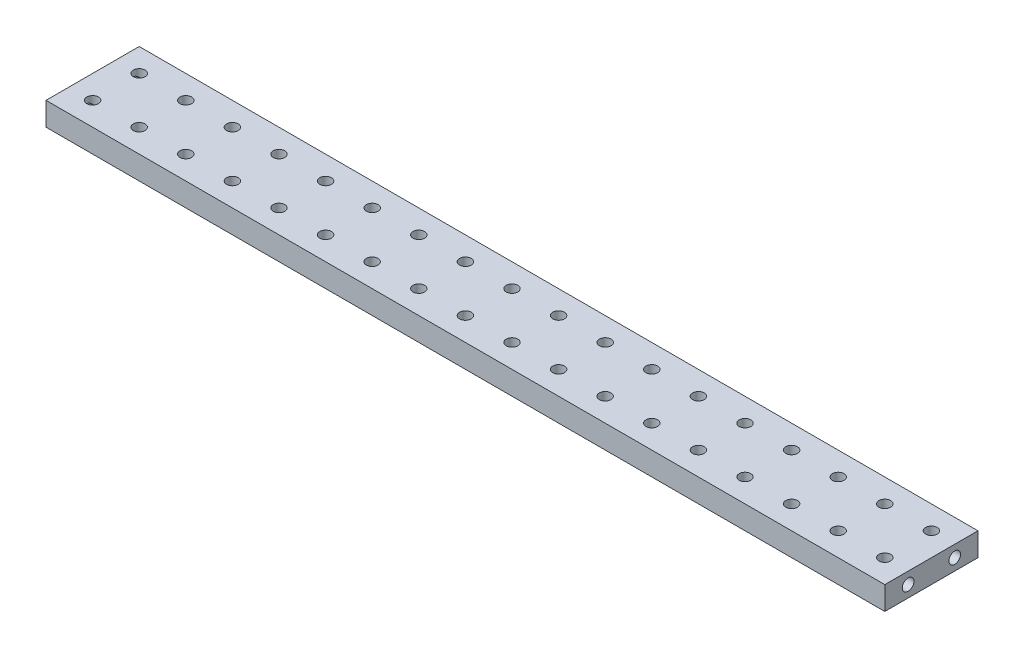
from build123d import *

# Parameters (mm, degrees)
SKETCH1_W           = 457.19999999999993
SKETCH1_H           = 50.79999999999999
BOSS_EXTRUDE1_DEPTH = 12.7
SKETCH2_R           = 3.1750000000000016
CUT_EXTRUDE1_DEPTH  = 12.7
CUT_EXTRUDE2_START  = -12.7
SKETCH3_R           = 3.1750000000000016
CUT_EXTRUDE2_DEPTH  = 12.7
SKETCH4_R           = 3.1749999999999963
SKETCH4_R_2         = 3.1749999999999674
SKETCH4_R_3         = 3.174999999999969
SKETCH4_R_4         = 3.1749999999999976
SKETCH4_R_5         = 3.17499999999997
CUT_EXTRUDE3_DEPTH  = 231.3571357696566


with BuildPart() as part:
    # Sketch1 → Boss-Extrude1 (new body)
    with BuildSketch(Plane(origin=(0, 0, 0), x_dir=(1, 0, 0), z_dir=(0, 1, 0))):
        Rectangle(SKETCH1_W, SKETCH1_H)
    extrude(amount=BOSS_EXTRUDE1_DEPTH)

    # Sketch2 → Cut-Extrude1 (cut)
    with BuildSketch(Plane.ZY.offset(228.6)):
        with Locations((-12.699999999999996, 6.35)):
            Circle(SKETCH2_R)
        with Locations((12.700000000000003, 6.35)):
            Circle(SKETCH2_R)
    extrude(amount=-CUT_EXTRUDE1_DEPTH, mode=Mode.SUBTRACT)

    # Sketch3 → Cut-Extrude2 (cut)
    with BuildSketch(Plane(origin=(228.6, 0, 0), x_dir=(0, 0, -1), z_dir=(1, 0, 0)).offset(CUT_EXTRUDE2_START)):
        with Locations(Location((-12.699999999999996, 6.35, 0), (0, 0, 180))):
            Circle(SKETCH3_R)
        with Locations(Location((12.700000000000003, 6.35, 0), (0, 0, 180))):
            Circle(SKETCH3_R)
    extrude(amount=CUT_EXTRUDE2_DEPTH, mode=Mode.SUBTRACT)

    # Sketch4 → Cut-Extrude3 (cut, through all)
    with BuildSketch(Plane(origin=(0, 12.7, 0), x_dir=(1, 0, 0), z_dir=(0, 1, 0))):
        with Locations(Location((-215.9, 12.699999999999996, 0), (0, 0, 270))):
            Circle(SKETCH4_R)
        with Locations(Location((-190.50000000000003, 12.699999999999996, 0), (0, 0, 270))):
            Circle(SKETCH4_R)
        with Locations(Location((-165.10000000000005, 12.699999999999996, 0), (0, 0, 270))):
            Circle(SKETCH4_R_2)
        with Locations(Location((-139.7000000000001, 12.699999999999996, 0), (0, 0, 270))):
            Circle(SKETCH4_R_2)
        with Locations(Location((-114.30000000000011, 12.699999999999996, 0), (0, 0, 270))):
            Circle(SKETCH4_R_3)
        with Locations(Location((-88.90000000000015, 12.699999999999996, 0), (0, 0, 270))):
            Circle(SKETCH4_R_3)
        with Locations(Location((-63.50000000000017, 12.699999999999996, 0), (0, 0, 270))):
            Circle(SKETCH4_R_3)
        with Locations(Location((-38.100000000000186, 12.699999999999996, 0), (0, 0, 270))):
            Circle(SKETCH4_R_3)
        with Locations(Location((-12.70000000000021, 12.699999999999996, 0), (0, 0, 270))):
            Circle(SKETCH4_R_3)
        with Locations(Location((12.699999999999767, 12.699999999999996, 0), (0, 0, 270))):
            Circle(SKETCH4_R_3)
        with Locations(Location((38.09999999999972, 12.699999999999996, 0), (0, 0, 270))):
            Circle(SKETCH4_R_3)
        with Locations(Location((63.499999999999694, 12.699999999999996, 0), (0, 0, 270))):
            Circle(SKETCH4_R_3)
        with Locations(Location((88.89999999999968, 12.699999999999996, 0), (0, 0, 270))):
            Circle(SKETCH4_R_4)
        with Locations(Location((114.29999999999966, 12.699999999999996, 0), (0, 0, 270))):
            Circle(SKETCH4_R_4)
        with Locations(Location((139.69999999999962, 12.699999999999996, 0), (0, 0, 270))):
            Circle(SKETCH4_R)
        with Locations(Location((165.0999999999996, 12.699999999999996, 0), (0, 0, 270))):
            Circle(SKETCH4_R)
        with Locations(Location((190.49999999999957, 12.699999999999996, 0), (0, 0, 270))):
            Circle(SKETCH4_R)
        with Locations(Location((215.89999999999955, 12.699999999999996, 0), (0, 0, 270))):
            Circle(SKETCH4_R)
        with Locations((241.29999999999956, 12.699999999999996)):
            Circle(SKETCH4_R)
        with Locations((266.6999999999995, 12.699999999999996)):
            Circle(SKETCH4_R_5)
        with Locations((292.09999999999945, 12.699999999999996)):
            Circle(SKETCH4_R_5)
        with Locations((317.49999999999943, 12.699999999999996)):
            Circle(SKETCH4_R_5)
        with Locations((342.8999999999994, 12.699999999999996)):
            Circle(SKETCH4_R_5)
        with Locations((368.2999999999994, 12.699999999999996)):
            Circle(SKETCH4_R_5)
        with Locations(Location((-190.49999999999977, -12.700000000000003, 0), (0, 0, 270))):
            Circle(SKETCH4_R_5)
        with Locations(Location((-165.0999999999998, -12.700000000000003, 0), (0, 0, 270))):
            Circle(SKETCH4_R_2)
        with Locations(Location((-139.69999999999982, -12.700000000000003, 0), (0, 0, 270))):
            Circle(SKETCH4_R_2)
        with Locations(Location((-114.29999999999984, -12.700000000000003, 0), (0, 0, 270))):
            Circle(SKETCH4_R_3)
        with Locations(Location((-88.89999999999986, -12.700000000000003, 0), (0, 0, 270))):
            Circle(SKETCH4_R_3)
        with Locations(Location((-63.499999999999886, -12.700000000000003, 0), (0, 0, 270))):
            Circle(SKETCH4_R_3)
        with Locations(Location((-38.09999999999991, -12.700000000000003, 0), (0, 0, 270))):
            Circle(SKETCH4_R_3)
        with Locations(Location((-12.699999999999934, -12.700000000000003, 0), (0, 0, 270))):
            Circle(SKETCH4_R_3)
        with Locations(Location((12.700000000000045, -12.700000000000003, 0), (0, 0, 270))):
            Circle(SKETCH4_R_3)
        with Locations(Location((38.099999999999994, -12.700000000000003, 0), (0, 0, 270))):
            Circle(SKETCH4_R_3)
        with Locations(Location((63.49999999999997, -12.700000000000003, 0), (0, 0, 270))):
            Circle(SKETCH4_R_3)
        with Locations(Location((88.89999999999995, -12.700000000000003, 0), (0, 0, 270))):
            Circle(SKETCH4_R_4)
        with Locations(Location((114.29999999999993, -12.700000000000003, 0), (0, 0, 270))):
            Circle(SKETCH4_R_4)
        with Locations(Location((139.6999999999999, -12.700000000000003, 0), (0, 0, 270))):
            Circle(SKETCH4_R)
        with Locations(Location((165.09999999999988, -12.700000000000003, 0), (0, 0, 270))):
            Circle(SKETCH4_R)
        with Locations(Location((190.49999999999986, -12.700000000000003, 0), (0, 0, 270))):
            Circle(SKETCH4_R)
        with Locations(Location((215.89999999999984, -12.700000000000003, 0), (0, 0, 270))):
            Circle(SKETCH4_R)
        with Locations((241.2999999999998, -12.700000000000003)):
            Circle(SKETCH4_R)
        with Locations((266.6999999999998, -12.700000000000003)):
            Circle(SKETCH4_R_5)
        with Locations((292.0999999999997, -12.700000000000003)):
            Circle(SKETCH4_R_5)
        with Locations((317.49999999999966, -12.700000000000003)):
            Circle(SKETCH4_R_5)
        with Locations((342.89999999999964, -12.700000000000003)):
            Circle(SKETCH4_R_5)
        with Locations((368.2999999999996, -12.700000000000003)):
            Circle(SKETCH4_R_5)
        with Locations(Location((-215.89999999999972, -12.700000000000003, 0), (0, 0, 270))):
            Circle(SKETCH4_R)
    extrude(amount=-CUT_EXTRUDE3_DEPTH, mode=Mode.SUBTRACT)


solid = part.part
